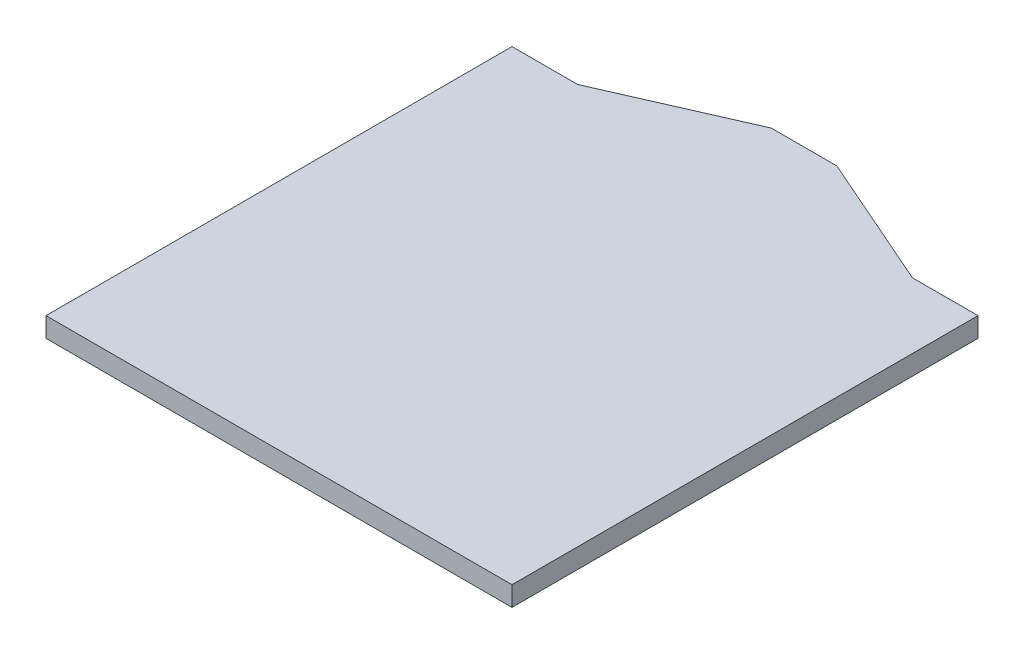
from build123d import *

# Parameters (mm, degrees)
BOSS_EXTRUDE1_DEPTH = 3


with BuildPart() as part:
    # Sketch1 → Boss-Extrude1 (new body)
    with BuildSketch(Plane(origin=(0, 0, 0), x_dir=(1, 0, 0), z_dir=(0, 1, 0))):
        Polygon((-5, 44.5), (-25.5, 35.5), (25.5, 35.5), (5, 44.5), align=None)
        Polygon((-25.5, 35.5), (-35.5, 35.5), (-35.5, -35.5), (35.5, -35.5), (35.5, 35.5), (25.5, 35.5), align=None)
    extrude(amount=BOSS_EXTRUDE1_DEPTH)


solid = part.part
